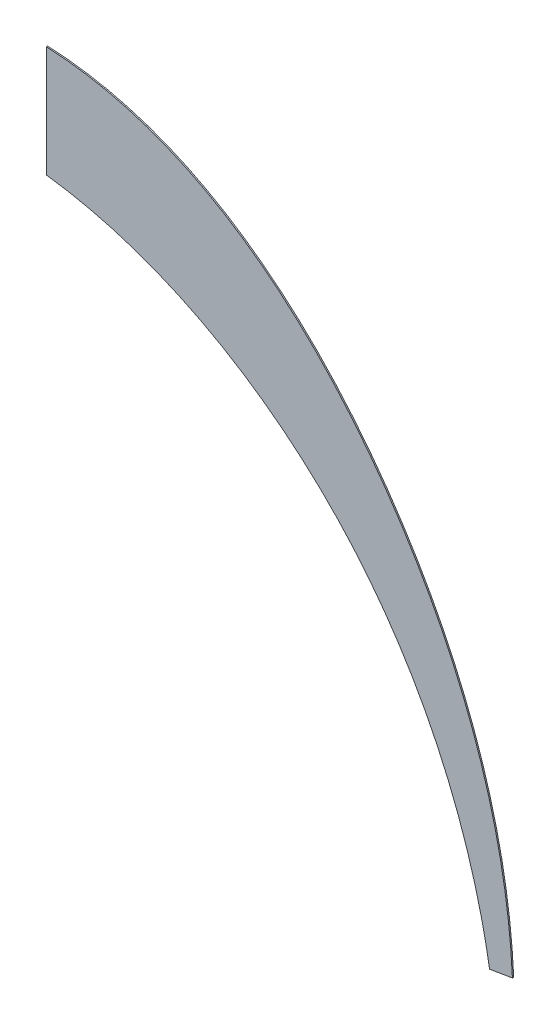
from build123d import *

# Parameters (mm, degrees)
BOSS_EXTRUDE1_DEPTH = 0.5


with BuildPart() as part:
    # Sketch1 → Boss-Extrude1 (new body)
    with BuildSketch(Plane.XY):
        with BuildLine():
            Line((0, 0), (0, 43.001818232))
            add(Edge.make_bspline(
                [(0, 43.001818232), (58.86514859, 40.423019823), (143.198103251, -32.085882035), (178.260941681, -131.126086471), (180.513560886, -179.070151115)],
                knots=[0, 0, 0, 0, 0.53971077, 1, 1, 1, 1], degree=3))
            Line((180.513560886, -179.070151115), (171.668005285, -180.545194688))
            add(Edge.make_bspline(
                [(0, 0), (46.120865415, -5.803642645), (127.896217096, -53.871203803), (164.721375091, -138.849603882), (171.668005285, -180.545194688)],
                knots=[0, 0, 0, 0, 0.520944634, 1, 1, 1, 1], degree=3))
        make_face()
    extrude(amount=BOSS_EXTRUDE1_DEPTH)


solid = part.part
